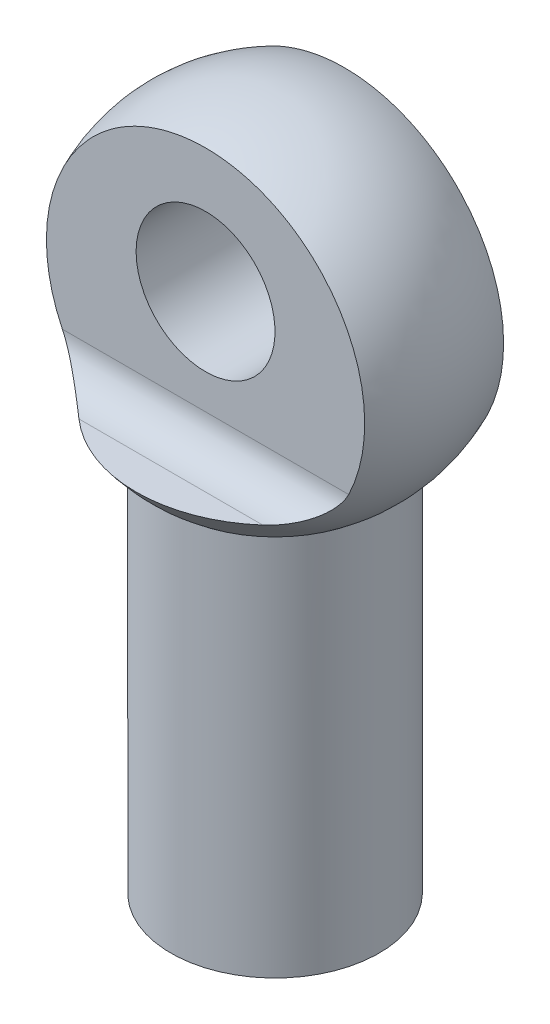
from build123d import *

# Parameters (mm, degrees)
CROQUIS4_W            = 3
CROQUIS4_H            = 11
CROQUIS7_W            = 4
CROQUIS7_H            = 8
CORTAR_EXTRUIR1_DEPTH = 7.5
CROQUIS9_W            = 5
CROQUIS9_H            = 8
CORTAR_EXTRUIR2_DEPTH = 7.5
REDONDEO3_R           = 1
CROQUIS10_R           = 2
CORTAR_EXTRUIR3_DEPTH = 7.5


with BuildPart() as part:
    # Croquis4 → Revolución2 (revolve)
    with BuildSketch(Plane(origin=(0, 0, 0), x_dir=(0, 0, -1), z_dir=(1, 0, 0)), mode=Mode.PRIVATE) as revoluci_n2_sk:
        with Locations((-1.5, 5.5)):
            Rectangle(CROQUIS4_W, CROQUIS4_H)
    revolve(revoluci_n2_sk.sketch.rotate(Axis((0, 0, 0), (0, 1, 0)), 180), axis=Axis((0, 0, 0), (0, 1, 0)))

    # Croquis5 → Revolución3 (revolve)
    with BuildSketch(Plane(origin=(0, 0, 0), x_dir=(0, 0, -1), z_dir=(1, 0, 0))):
        with BuildLine():
            Line((0, 20), (0, 11))
            Line((0, 11), (-3, 11))
            ThreePointArc((-3, 11), (-4.74341649, 16.58113883), (0, 20))
        make_face()
    revolve(axis=Axis((0, 20, 0), (0, 1, 0)))

    # Croquis7 → Cortar-Extruir1 (cut, symmetric)
    with BuildSketch(Plane(origin=(0, 0, 0), x_dir=(0, 0, -1), z_dir=(1, 0, 0))):
        with Locations((4, 16)):
            Rectangle(CROQUIS7_W, CROQUIS7_H)
    extrude(amount=CORTAR_EXTRUIR1_DEPTH, both=True, mode=Mode.SUBTRACT)

    # Croquis9 → Cortar-Extruir2 (cut, symmetric)
    with BuildSketch(Plane(origin=(0, 0, 0), x_dir=(0, 0, -1), z_dir=(1, 0, 0))):
        with Locations((-4.5, 16)):
            Rectangle(CROQUIS9_W, CROQUIS9_H)
    extrude(amount=CORTAR_EXTRUIR2_DEPTH, both=True, mode=Mode.SUBTRACT)

    # Redondeo3
    redondeo3_edges = [part.edges().sort_by_distance(p)[0] for p in [
        (0, 12, -2),
        (0, 12, 2),
    ]]
    fillet(redondeo3_edges, radius=REDONDEO3_R)

    # Croquis10 → Cortar-Extruir3 (cut, symmetric)
    with BuildSketch(Plane(origin=(0, 0, 0), x_dir=(-1, 0, 0), z_dir=(0, 0, -1))):
        with Locations((0, 16)):
            Circle(CROQUIS10_R)
    extrude(amount=CORTAR_EXTRUIR3_DEPTH, both=True, mode=Mode.SUBTRACT)


solid = part.part
